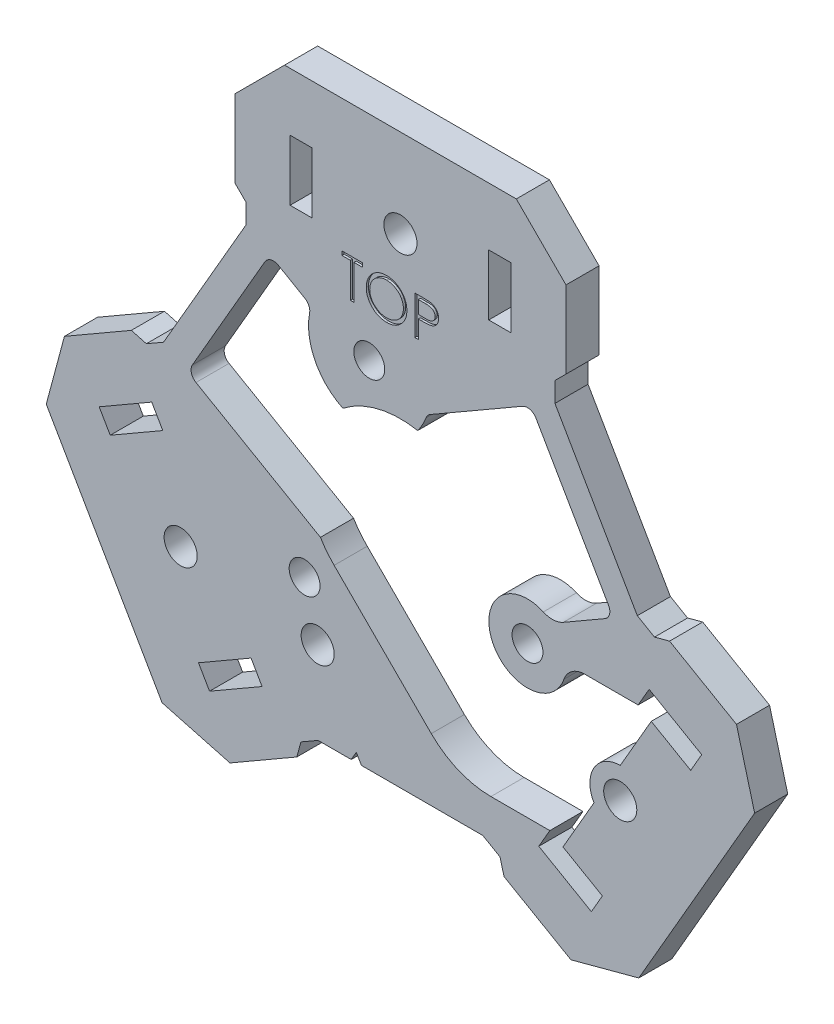
from build123d import *

# Parameters (mm, degrees)
SKETCH1_R           = 1.5
BOSS_EXTRUDE1_DEPTH = 3
SKETCH3_R           = 8.5
CUT_EXTRUDE2_DEPTH  = 45.723637698
SKETCH4_R           = 1.5
SKETCH4_R_2         = 1.4
CUT_EXTRUDE3_DEPTH  = 45.723637698
CUT_EXTRUDE4_DEPTH  = 45.723637698
CUT_EXTRUDE6_DEPTH  = 45.723637698
CUT_EXTRUDE7_DEPTH  = 0.2


with BuildPart() as part:
    # Sketch1 → Boss-Extrude1 (new body)
    with BuildSketch(Plane.XY):
        Polygon((0, -20.476245627), (7.465897773, -20.476245627), (9.02146997, -21.374355653), (9.387495374, -22.740381057), (11.136866689, -23.750381057), (15.4496732, -26.240381057), (21.596787517, -24.59326674), (32.096787517, -6.40673326), (30.4496732, -0.259618943), (26.136866689, 2.230381057), (24.387495374, 3.240381057), (23.02146997, 2.874355653), (21.465897773, 3.772465679), (17.732948887, 10.238122813), (14, 16.703779947), (14, 18.5), (15, 19.5), (15, 23), (15, 26.5), (10.5, 31), (-10.5, 31), (-15, 26.5), (-15, 23), (-15, 19.5), (-14, 18.5), (-14, 16.703779947), (-17.732948887, 10.238122813), (-21.465897773, 3.772465679), (-23.02146997, 2.874355653), (-24.387495374, 3.240381057), (-26.136866689, 2.230381057), (-30.4496732, -0.259618943), (-32.096787517, -6.40673326), (-21.596787517, -24.59326674), (-15.4496732, -26.240381057), (-11.136866689, -23.750381057), (-9.387495374, -22.740381057), (-9.02146997, -21.374355653), (-7.465897773, -20.476245627), align=None)
        with Locations((0, 23)):
            Circle(SKETCH1_R, mode=Mode.SUBTRACT)
        with Locations((19.918584287, -11.5)):
            Circle(SKETCH1_R, mode=Mode.SUBTRACT)
        with Locations((-19.918584287, -11.5)):
            Circle(SKETCH1_R, mode=Mode.SUBTRACT)
        Polygon((8, 23), (8, 25.75), (10, 25.75), (10, 23), (10, 20.25), (8, 20.25), align=None, mode=Mode.SUBTRACT)
        Polygon((12.537014427, -18.785254038), (13.636866689, -19.420254038), (17.300154147, -21.535254038), (18.300154147, -19.80320323), (15.918584287, -18.42820323), (13.537014427, -17.05320323), align=None, mode=Mode.SUBTRACT)
        Polygon((-8, 23), (-8, 20.25), (-10, 20.25), (-10, 23), (-10, 25.75), (-8, 25.75), align=None, mode=Mode.SUBTRACT)
        Polygon((27.300154147, -4.214745962), (23.636866689, -2.099745962), (22.537014427, -1.464745962), (21.537014427, -3.19679677), (23.918584287, -4.57179677), (26.300154147, -5.94679677), align=None, mode=Mode.SUBTRACT)
        Polygon((-22.537014427, -1.464745962), (-23.636866689, -2.099745962), (-27.300154147, -4.214745962), (-26.300154147, -5.94679677), (-23.918584287, -4.57179677), (-21.537014427, -3.19679677), align=None, mode=Mode.SUBTRACT)
        Polygon((-17.300154147, -21.535254038), (-13.636866689, -19.420254038), (-12.537014427, -18.785254038), (-13.537014427, -17.05320323), (-15.918584287, -18.42820323), (-18.300154147, -19.80320323), align=None, mode=Mode.SUBTRACT)
    extrude(amount=BOSS_EXTRUDE1_DEPTH)

    # Sketch3 → Cut-Extrude2 (cut, through all)
    with BuildSketch(Plane.XY.offset(3)):
        Circle(SKETCH3_R)
    extrude(amount=-CUT_EXTRUDE2_DEPTH, mode=Mode.SUBTRACT)

    # Sketch4 → Cut-Extrude3 (cut, through all)
    with BuildSketch(Plane.XY.offset(3)):
        with Locations((-7.5, -12.990381057)):
            Circle(SKETCH4_R)
        with Locations((-2.828013453, 11.662004112)):
            Circle(SKETCH4_R_2)
        with Locations((11.513598547, -3.381870563)):
            Circle(SKETCH4_R_2)
        with Locations((-8.685585093, -8.280133549)):
            Circle(SKETCH4_R_2)
    extrude(amount=-CUT_EXTRUDE3_DEPTH, mode=Mode.SUBTRACT)

    # Sketch6 → Cut-Extrude4 (cut, through all)
    with BuildSketch(Plane.XY.offset(3)):
        with BuildLine():
            Line((12.279936491, 14.683017338), (18.855834264, 3.293228289))
            ThreePointArc((18.855834264, 3.293228289), (18.94474564, 2.617879339), (18.530071655, 2.077465679))
            Line((18.530071655, 2.077465679), (14.765452722, -0.096038075))
            ThreePointArc((14.765452722, -0.096038075), (13.867180531, -0.361398455), (12.946596658, -0.188672102))
            ThreePointArc((12.946596658, -0.188672102), (8.298590932, -4.765245436), (14.817548225, -4.536823604))
            ThreePointArc((14.817548225, -4.536823604), (15.547924188, -3.565854353), (16.705519469, -3.19679677))
            Line((16.705519469, -3.19679677), (21.537014427, -3.19679677))
            Line((21.537014427, -3.19679677), (22.727799357, -3.88429677))
            Line((22.727799357, -3.88429677), (19.918584287, -8.75))
            ThreePointArc((19.918584287, -8.75), (17.537014427, -10.125), (17.537014427, -12.875))
            Line((17.537014427, -12.875), (14.727799357, -17.74070323))
            Line((14.727799357, -17.74070323), (13.537014427, -17.05320323))
            Line((13.537014427, -17.05320323), (8.197560613, -17.05320323))
            ThreePointArc((8.197560613, -17.05320323), (5.273322373, -16.471536079), (2.794272897, -14.815088177))
            Line((2.794272897, -14.815088177), (-6.01040764, -6.01040764))
            ThreePointArc((-6.01040764, -6.01040764), (-6.677816527, -5.258970093), (-7.251866025, -4.434009377))
            Line((-7.251866025, -4.434009377), (-18.530071655, 2.077465679))
            ThreePointArc((-18.530071655, 2.077465679), (-18.94474564, 2.617879339), (-18.855834264, 3.293228289))
            Line((-18.855834264, 3.293228289), (-12.279936491, 14.683017338))
            ThreePointArc((-12.279936491, 14.683017338), (-11.739522831, 15.097691323), (-11.064173881, 15.008779947))
            Line((-11.064173881, 15.008779947), (-8.661456405, 13.621570365))
            ThreePointArc((-8.661456405, 13.621570365), (-8.297489138, 13.22184948), (-8.231994085, 12.685231036))
            ThreePointArc((-8.231994085, 12.685231036), (-7.739212382, 9.18609517), (-5.219155039, 6.708980599))
            ThreePointArc((-5.219155039, 6.708980599), (-2.003176196, 8.260586246), (1.566304328, 8.354441379))
            ThreePointArc((1.566304328, 8.354441379), (1.992424614, 9.013726022), (2.320345845, 9.726959788))
            ThreePointArc((2.320345845, 9.726959788), (2.474664435, 9.989471751), (2.708443986, 10.184597043))
            Line((2.708443986, 10.184597043), (11.064173881, 15.008779947))
            ThreePointArc((11.064173881, 15.008779947), (11.739522831, 15.097691323), (12.279936491, 14.683017338))
        make_face()
    extrude(amount=-CUT_EXTRUDE4_DEPTH, mode=Mode.SUBTRACT)

    # Sketch8 → Cut-Extrude6 (cut, through all)
    with BuildSketch(Plane.XY.offset(3)):
        Polygon((-4.461880215, -20.476245627), (-4, -19.676245627), (-3.538119785, -20.476245627), align=None)
    extrude(amount=-CUT_EXTRUDE6_DEPTH, mode=Mode.SUBTRACT)

    # Sketch9 → Cut-Extrude7 (cut)
    # profile 1 of 3: a face of its own
    with BuildSketch(Plane.XY.offset(3)):
        Polygon((-5.2961661, 18.663389034), (-5.2961661, 19.022363393), (-3.45642251, 19.022363393), (-3.45642251, 18.663389034), (-4.219243023, 18.663389034), (-4.219243023, 15.522363393), (-4.533345587, 15.522363393), (-4.533345587, 18.663389034), align=None)
    # profile 2 of 3: a face of its own
    with BuildSketch(Plane.XY.offset(3)):
        with BuildLine():
            add(Edge.make_bspline(
                [(-1.280140459, 19.112106983), (-1.215332353, 19.110465504), (-1.088043886, 19.107241503), (-0.900968989, 19.082562399), (-0.722373893, 19.039867009), (-0.550803755, 18.983004027), (-0.388310778, 18.907149641), (-0.233671885, 18.815464493), (-0.087255012, 18.706988034), (0.04896637, 18.582558807), (0.17362332, 18.447175353), (0.283449206, 18.302697443), (0.3754915, 18.149998641), (0.451077287, 17.98953781), (0.510375897, 17.821677842), (0.551294941, 17.64552384), (0.577433091, 17.46221715), (0.580488868, 17.337190285), (0.582039028, 17.273765637)],
                knots=[0, 0, 0, 0, 1.065120563, 2.091984664, 3.0946048, 4.079830382, 5.057816894, 6.036188127, 7.030412546, 8.04752943, 9.064399622, 10.05169764, 11.02544977, 11.989514704, 12.962713494, 13.945757189, 14.957906945, 16, 16, 16, 16], degree=3))
            add(Edge.make_bspline(
                [(0.582039028, 17.273765637), (0.580489095, 17.21080819), (0.577433999, 17.08671177), (0.551265221, 16.904568326), (0.510224221, 16.729477629), (0.451627955, 16.561731977), (0.376402477, 16.401154413), (0.283747306, 16.248167459), (0.174606095, 16.102720961), (0.050399244, 15.966408295), (-0.085001798, 15.841410825), (-0.230232065, 15.732491949), (-0.382025385, 15.638767824), (-0.542335093, 15.56398415), (-0.70903513, 15.50421223), (-0.883617453, 15.4634596), (-1.065264007, 15.437172557), (-1.189135011, 15.434154041), (-1.252095587, 15.432619803)],
                knots=[0, 0, 0, 0, 1.043624062, 2.057103931, 3.04512605, 4.022047818, 4.998200453, 5.980619268, 6.982898556, 8.009068085, 9.034988726, 10.034168286, 11.015286542, 11.987931943, 12.962482838, 13.94673481, 14.956375938, 16, 16, 16, 16], degree=3))
            add(Edge.make_bspline(
                [(-1.252095587, 15.432619803), (-1.315519906, 15.43416919), (-1.440546122, 15.437223444), (-1.624083158, 15.463404849), (-1.800360902, 15.504346153), (-1.968875253, 15.562855589), (-2.129720182, 15.63847282), (-2.283210265, 15.730677199), (-2.428729412, 15.84008434), (-2.565071159, 15.964250915), (-2.689820357, 16.099422467), (-2.798579733, 16.244256722), (-2.890804846, 16.395912178), (-2.966168178, 16.554809702), (-3.025832638, 16.720181145), (-3.066537456, 16.893129623), (-3.092873408, 17.072669128), (-3.095908254, 17.194912027), (-3.097448151, 17.256938714)],
                knots=[0, 0, 0, 0, 1.053102029, 2.075944431, 3.073151272, 4.055350789, 5.033113405, 6.020478099, 7.024410459, 8.052272461, 9.079885166, 10.07527673, 11.055994387, 12.023226415, 12.992069828, 13.970394897, 14.97016774, 16, 16, 16, 16], degree=3))
            add(Edge.make_bspline(
                [(-3.097448151, 17.256938714), (-3.096913516, 17.298571383), (-3.09585099, 17.381311506), (-3.083059297, 17.504178107), (-3.064497596, 17.625068764), (-3.037895683, 17.743639712), (-3.003104016, 17.859600697), (-2.962051989, 17.97375146), (-2.911912144, 18.084935184), (-2.855231496, 18.193678575), (-2.791969688, 18.298286481), (-2.722093938, 18.397166064), (-2.64805857, 18.491147061), (-2.566895176, 18.577794065), (-2.481278731, 18.659627721), (-2.389820353, 18.735390438), (-2.293078108, 18.805765389), (-2.190635729, 18.86918573), (-2.085017454, 18.926544865), (-1.976140676, 18.975766716), (-1.865484104, 19.018012777), (-1.752529457, 19.052253603), (-1.637576684, 19.079285639), (-1.5203749, 19.097692992), (-1.401017474, 19.11051731), (-1.320606155, 19.111574812), (-1.280140459, 19.112106983)],
                knots=[0, 0, 0, 0, 1.037015668, 2.060948919, 3.074880161, 4.083647147, 5.086022904, 6.090072063, 7.104153813, 8.122640571, 9.144368836, 10.147691507, 11.138137339, 12.123020368, 13.103399296, 14.087645067, 15.080126199, 16.082011238, 17.087798457, 18.072939717, 19.057185487, 20.037253025, 21.01195951, 21.997135196, 22.992090687, 24, 24, 24, 24], degree=3))
        make_face()
        with BuildLine():
            add(Edge.make_bspline(
                [(-1.26471578, 18.753132624), (-1.297930413, 18.752727734), (-1.364042146, 18.751921824), (-1.462326682, 18.741306108), (-1.559318616, 18.726176219), (-1.655037978, 18.704594699), (-1.749084268, 18.675190646), (-1.842334109, 18.641349738), (-1.933937163, 18.600128647), (-2.023591021, 18.553555943), (-2.110506096, 18.502007022), (-2.192518797, 18.445035255), (-2.269841441, 18.383976701), (-2.342284708, 18.318688863), (-2.40963588, 18.248839261), (-2.473220582, 18.175486825), (-2.530490163, 18.096534934), (-2.58297574, 18.014124527), (-2.62994358, 17.928362946), (-2.671708935, 17.840153084), (-2.705872944, 17.748775397), (-2.73373532, 17.65522124), (-2.756835131, 17.55963878), (-2.771469055, 17.461302931), (-2.782201414, 17.360707819), (-2.78296126, 17.292725965), (-2.783345587, 17.258340957)],
                knots=[0, 0, 0, 0, 1.008559885, 2.007477868, 2.99961109, 3.989939068, 4.984837346, 5.991145699, 7.001802488, 8.033829008, 9.059044045, 10.069351652, 11.065060232, 12.050310815, 13.029377138, 14.011219647, 14.996725999, 15.989392538, 16.977580475, 17.965360261, 18.951710183, 19.937753436, 20.929683414, 21.935841486, 22.955955122, 24, 24, 24, 24], degree=3))
            add(Edge.make_bspline(
                [(-2.783345587, 17.258340957), (-2.782070725, 17.207778737), (-2.779562678, 17.108307206), (-2.757605107, 16.962539062), (-2.723783133, 16.822450776), (-2.673925767, 16.688808867), (-2.611575152, 16.560464584), (-2.534548262, 16.438556479), (-2.443289176, 16.323051605), (-2.339625649, 16.214756336), (-2.226302943, 16.115910532), (-2.105970213, 16.029147123), (-1.979916605, 15.955736873), (-1.847813403, 15.895931801), (-1.710365864, 15.848542063), (-1.566688313, 15.816063432), (-1.417737853, 15.794687976), (-1.316207198, 15.792635221), (-1.26471578, 15.791594162)],
                knots=[0, 0, 0, 0, 1.032063989, 2.030389145, 3.003944642, 3.970395727, 4.937377036, 5.913328081, 6.909231446, 7.93887556, 8.970685674, 9.976071282, 10.964166581, 11.944589148, 12.933237628, 13.927779006, 14.949070134, 16, 16, 16, 16], degree=3))
            add(Edge.make_bspline(
                [(-1.26471578, 15.791594162), (-1.230106278, 15.792069667), (-1.161465242, 15.793012735), (-1.059369719, 15.802511412), (-0.959113508, 15.817743281), (-0.860837228, 15.839673937), (-0.764652416, 15.867121143), (-0.670157613, 15.899728871), (-0.578359323, 15.940410075), (-0.488099485, 15.985358026), (-0.401703243, 16.036598184), (-0.319227711, 16.091636333), (-0.242751731, 16.152604954), (-0.17036266, 16.216922767), (-0.102734971, 16.285886615), (-0.040325987, 16.359406836), (0.016654146, 16.437947494), (0.069119792, 16.520232899), (0.115923055, 16.606229152), (0.156702154, 16.69475883), (0.19129827, 16.785603939), (0.219226775, 16.878895511), (0.241112236, 16.97445636), (0.256192156, 17.072414438), (0.266740595, 17.17257378), (0.267535672, 17.240317636), (0.267936464, 17.274466759)],
                knots=[0, 0, 0, 0, 1.047197238, 2.076906641, 3.100256066, 4.114471768, 5.12198147, 6.126382909, 7.136867548, 8.15857795, 9.17633901, 10.174870724, 11.156907918, 12.133735059, 13.104061851, 14.077631395, 15.04955518, 16.038496417, 17.029181396, 18.010275684, 18.986308667, 19.968651475, 20.955262928, 21.950658345, 22.966943676, 24, 24, 24, 24], degree=3))
            add(Edge.make_bspline(
                [(0.267936464, 17.274466759), (0.267535351, 17.308382263), (0.266739669, 17.375659913), (0.256197195, 17.475120731), (0.241096304, 17.572373943), (0.219333596, 17.667037746), (0.191283443, 17.759136271), (0.156696112, 17.848583019), (0.115910813, 17.935711214), (0.069102588, 18.020305511), (0.016486765, 18.101480249), (-0.041007478, 18.179082661), (-0.104372826, 18.251655403), (-0.171798851, 18.320990097), (-0.244969737, 18.385607986), (-0.323554031, 18.445530507), (-0.406597709, 18.502203781), (-0.494524944, 18.553329343), (-0.585268898, 18.600543576), (-0.678382856, 18.640994579), (-0.772811955, 18.675366698), (-0.868316068, 18.704683663), (-0.965699046, 18.726091693), (-1.064302875, 18.741319743), (-1.163991133, 18.751918129), (-1.231034353, 18.752726508), (-1.26471578, 18.753132624)],
                knots=[0, 0, 0, 0, 1.02996197, 2.043119294, 3.035359645, 4.018872909, 4.991431989, 5.957985074, 6.929999688, 7.912076566, 8.892894881, 9.867085534, 10.843653904, 11.817741046, 12.803660682, 13.806313499, 14.818574707, 15.856120519, 16.894564902, 17.924820532, 18.937903209, 19.946497019, 20.957711757, 21.963978472, 22.977135795, 24, 24, 24, 24], degree=3))
        make_face(mode=Mode.SUBTRACT)
    # profile 3 of 3: a face of its own
    with BuildSketch(Plane.XY.offset(3)):
        with BuildLine():
            Line((1.299987746, 19.022363393), (1.986385983, 19.022363393))
            add(Edge.make_bspline(
                [(1.986385983, 19.022363393), (2.033596889, 19.022311497), (2.124055082, 19.022212061), (2.253770138, 19.019197316), (2.371579869, 19.015170624), (2.47723025, 19.00958873), (2.571046348, 19.00299214), (2.652603648, 18.993740101), (2.722543204, 18.984079805), (2.764449654, 18.974258399), (2.783561464, 18.969779259)],
                knots=[0, 0, 0, 0, 1.415646017, 2.712440637, 3.8905458, 4.950247383, 5.884950622, 6.709939814, 7.411656543, 8, 8, 8, 8], degree=3))
            add(Edge.make_bspline(
                [(2.783561464, 18.969779259), (2.807754998, 18.963157309), (2.855571975, 18.950069447), (2.924473018, 18.923855724), (2.990026863, 18.892773558), (3.052458422, 18.857349619), (3.111000505, 18.816064054), (3.166526546, 18.770590437), (3.218546526, 18.719878868), (3.266767918, 18.664498128), (3.311052716, 18.605377918), (3.349182398, 18.541635688), (3.381109625, 18.474344385), (3.408492897, 18.403550814), (3.428201351, 18.32866049), (3.443048251, 18.250193778), (3.452471879, 18.168159088), (3.453374441, 18.11209922), (3.4538339, 18.08356131)],
                knots=[0, 0, 0, 0, 0.999701418, 1.975846123, 2.934577507, 3.890451536, 4.834027766, 5.787354733, 6.749476667, 7.726910423, 8.712836071, 9.690891519, 10.682875813, 11.679750201, 12.712814741, 13.765529915, 14.8625177, 16, 16, 16, 16], degree=3))
            add(Edge.make_bspline(
                [(3.4538339, 18.08356131), (3.453412475, 18.054783533), (3.452587929, 17.998477869), (3.442691644, 17.916105081), (3.429361452, 17.837386691), (3.4088644, 17.76249724), (3.382018727, 17.69188147), (3.350526674, 17.624460238), (3.312543144, 17.561380566), (3.268898314, 17.502413448), (3.220346719, 17.447503536), (3.167093781, 17.397048742), (3.109354489, 17.351344403), (3.047312341, 17.31028806), (2.980362492, 17.27483178), (2.909520338, 17.243074475), (2.834170122, 17.216403414), (2.782027608, 17.202373353), (2.755516592, 17.195239996)],
                knots=[0, 0, 0, 0, 1.121902311, 2.195077645, 3.232258892, 4.234102512, 5.217864754, 6.176164875, 7.132989551, 8.084763148, 9.034132444, 9.988522005, 10.94243251, 11.903244335, 12.886203696, 13.894208494, 14.929344452, 16, 16, 16, 16], degree=3))
            add(Edge.make_bspline(
                [(2.755516592, 17.195239996), (2.733589258, 17.190577015), (2.685534231, 17.180357821), (2.606391509, 17.168949364), (2.514246123, 17.159211763), (2.409223843, 17.151910625), (2.291418938, 17.145660257), (2.16076768, 17.140692163), (2.017013603, 17.137962309), (1.916742359, 17.137821516), (1.864390791, 17.137748009)],
                knots=[0, 0, 0, 0, 0.601384939, 1.31797006, 2.144135048, 3.087295005, 4.142315834, 5.309527816, 6.595305764, 8, 8, 8, 8], degree=3))
            Line((1.864390791, 17.137748009), (1.61409031, 17.137748009))
            Line((1.61409031, 17.137748009), (1.61409031, 15.522363393))
            Line((1.61409031, 15.522363393), (1.299987746, 15.522363393))
            Line((1.299987746, 15.522363393), (1.299987746, 19.022363393))
        make_face()
        with BuildLine():
            Line((1.61409031, 18.663389034), (1.61409031, 17.496722368))
            Line((1.61409031, 17.496722368), (2.226870759, 17.489010028))
            add(Edge.make_bspline(
                [(2.226870759, 17.489010028), (2.256790685, 17.488994564), (2.314550485, 17.488964712), (2.397986708, 17.492949936), (2.475395995, 17.497550468), (2.54654057, 17.504286392), (2.611452505, 17.513807649), (2.670240034, 17.523419387), (2.722447317, 17.53732475), (2.783546518, 17.556047819), (2.851629866, 17.587980434), (2.925697414, 17.634330325), (2.988468001, 17.693411033), (3.042786298, 17.759838864), (3.085892175, 17.833737993), (3.117448168, 17.91280693), (3.135989325, 17.99623478), (3.138475519, 18.053322919), (3.139731336, 18.082159066)],
                knots=[0, 0, 0, 0, 1.160613943, 2.240541288, 3.23993089, 4.169200891, 5.011653406, 5.7853311, 6.478053781, 7.106038997, 8.262395093, 9.384106736, 10.481365981, 11.59014053, 12.70357646, 13.786202915, 14.881775077, 16, 16, 16, 16], degree=3))
            add(Edge.make_bspline(
                [(3.139731336, 18.082159066), (3.138468689, 18.11029758), (3.135958704, 18.166233462), (3.117302841, 18.248212222), (3.085953527, 18.326447927), (3.042496933, 18.399421012), (2.989755803, 18.465609816), (2.92845646, 18.523106943), (2.858743198, 18.569328646), (2.793894967, 18.599161928), (2.736293781, 18.617377203), (2.686261821, 18.630122044), (2.629771147, 18.64029765), (2.566803367, 18.648537153), (2.497846533, 18.655590614), (2.422308219, 18.660376591), (2.340474575, 18.663178047), (2.283664004, 18.663317003), (2.254214509, 18.663389034)],
                knots=[0, 0, 0, 0, 1.120700087, 2.227813068, 3.331159281, 4.466773991, 5.599788987, 6.693661531, 7.80175334, 8.91857717, 9.525282508, 10.207424825, 10.974604443, 11.810962634, 12.737642355, 13.736264703, 14.826523623, 16, 16, 16, 16], degree=3))
            Line((2.254214509, 18.663389034), (1.61409031, 18.663389034))
        make_face(mode=Mode.SUBTRACT)
    extrude(amount=-CUT_EXTRUDE7_DEPTH, mode=Mode.SUBTRACT)


solid = part.part
